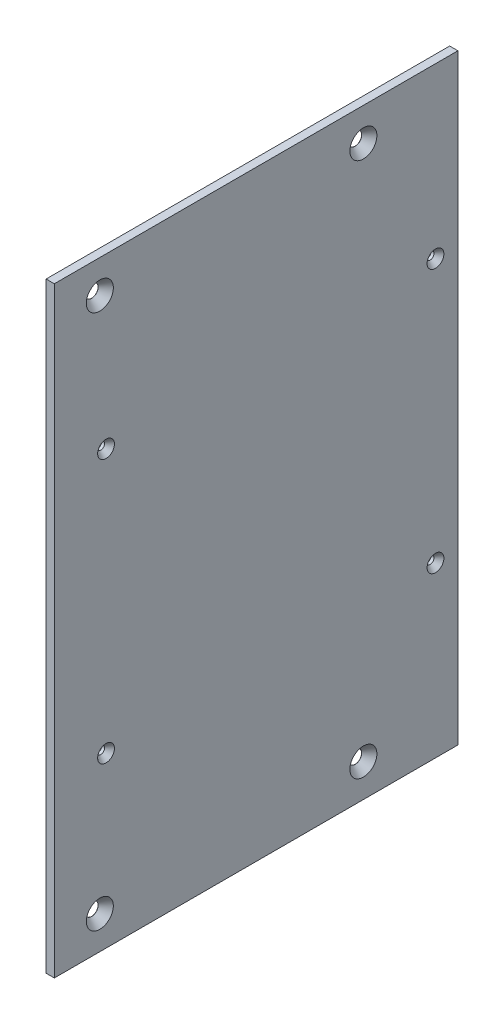
from build123d import *

# Parameters (mm, degrees)
SKETCH1_W                       = 231.775000504
SKETCH1_H                       = 155.575
BOSS_EXTRUDE1_DEPTH             = 3.175
F_10_CLEARANCE_HOLE1_AT_2_COUNT = 2
F_10_CLEARANCE_HOLE1_AT_2_PITCH = 101.6
F_10_CLEARANCE_HOLE1_AT_3_COUNT = 2
F_10_CLEARANCE_HOLE1_AT_3_PITCH = 230.028695701
F_10_CLEARANCE_HOLE1_AT_4_COUNT = 2
F_10_CLEARANCE_HOLE1_AT_4_PITCH = 206.375000535
F_4_CLEARANCE_HOLE1_AT_2_COUNT  = 2
F_4_CLEARANCE_HOLE1_AT_2_PITCH  = 101.6
F_4_CLEARANCE_HOLE1_AT_3_COUNT  = 2
F_4_CLEARANCE_HOLE1_AT_3_PITCH  = 162.639355631
F_4_CLEARANCE_HOLE1_AT_4_COUNT  = 2
F_4_CLEARANCE_HOLE1_AT_4_PITCH  = 127


with BuildPart() as part:
    # Sketch1 → Boss-Extrude1 (new body)
    with BuildSketch(Plane.YZ.offset(19.05)):
        with Locations((-91.578028487, 103.052517839)):
            Rectangle(SKETCH1_W, SKETCH1_H)
    extrude(amount=BOSS_EXTRUDE1_DEPTH)

    # Sketch5 → #10 Clearance Hole1 (revolve, cut)
    with BuildSketch(Plane(origin=(19.05, -194.76552877, 163.300645755), x_dir=(0, 0, 1), z_dir=(0, 1, 0))):
        Polygon((0, 0), (0, 3.175), (5.207, 3.175), (2.4892, 0.048528743), (2.4892, 0), align=None)
    f_10_clearance_hole1 = revolve(axis=Axis((12.7, -194.76552877, 163.300645755), (1, 0, 0)), mode=Mode.SUBTRACT)

    # #10 Clearance Hole1 at 2: #10 Clearance Hole1 ×2
    with Locations(*[(0, 0, -i * F_10_CLEARANCE_HOLE1_AT_2_PITCH) for i in range(1, F_10_CLEARANCE_HOLE1_AT_2_COUNT)]):
        add(f_10_clearance_hole1, mode=Mode.SUBTRACT)

    # #10 Clearance Hole1 at 3: #10 Clearance Hole1 ×2
    with Locations(*[Vector(0, 0.8971706764945216, -0.44168402420549757) * (i * F_10_CLEARANCE_HOLE1_AT_3_PITCH) for i in range(1, F_10_CLEARANCE_HOLE1_AT_3_COUNT)]):
        add(f_10_clearance_hole1, mode=Mode.SUBTRACT)

    # #10 Clearance Hole1 at 4: #10 Clearance Hole1 ×2
    with Locations(*[(0, i * F_10_CLEARANCE_HOLE1_AT_4_PITCH, 0) for i in range(1, F_10_CLEARANCE_HOLE1_AT_4_COUNT)]):
        add(f_10_clearance_hole1, mode=Mode.SUBTRACT)

    # Sketch11 → #4 Clearance Hole1 (revolve, cut)
    with BuildSketch(Plane(origin=(22.225, -40.778028487, 160.910543982), x_dir=(0, 0, -1), z_dir=(0, 1, 0))):
        Polygon((0, 0), (0, 3.175), (1.4732, 3.175), (1.4732, 2.030745349), (3.2385, 0), align=None)
    f_4_clearance_hole1 = revolve(axis=Axis((28.575, -40.778028487, 160.910543982), (-1, 0, 0)), mode=Mode.SUBTRACT)

    # #4 Clearance Hole1 at 2: #4 Clearance Hole1 ×2
    with Locations(*[(0, -i * F_4_CLEARANCE_HOLE1_AT_2_PITCH, 0) for i in range(1, F_4_CLEARANCE_HOLE1_AT_2_COUNT)]):
        add(f_4_clearance_hole1, mode=Mode.SUBTRACT)

    # #4 Clearance Hole1 at 3: #4 Clearance Hole1 ×2
    with Locations(*[Vector(0, -0.6246950475544236, -0.7808688094430308) * (i * F_4_CLEARANCE_HOLE1_AT_3_PITCH) for i in range(1, F_4_CLEARANCE_HOLE1_AT_3_COUNT)]):
        add(f_4_clearance_hole1, mode=Mode.SUBTRACT)

    # #4 Clearance Hole1 at 4: #4 Clearance Hole1 ×2
    with Locations(*[(0, 0, -i * F_4_CLEARANCE_HOLE1_AT_4_PITCH) for i in range(1, F_4_CLEARANCE_HOLE1_AT_4_COUNT)]):
        add(f_4_clearance_hole1, mode=Mode.SUBTRACT)


solid = part.part
